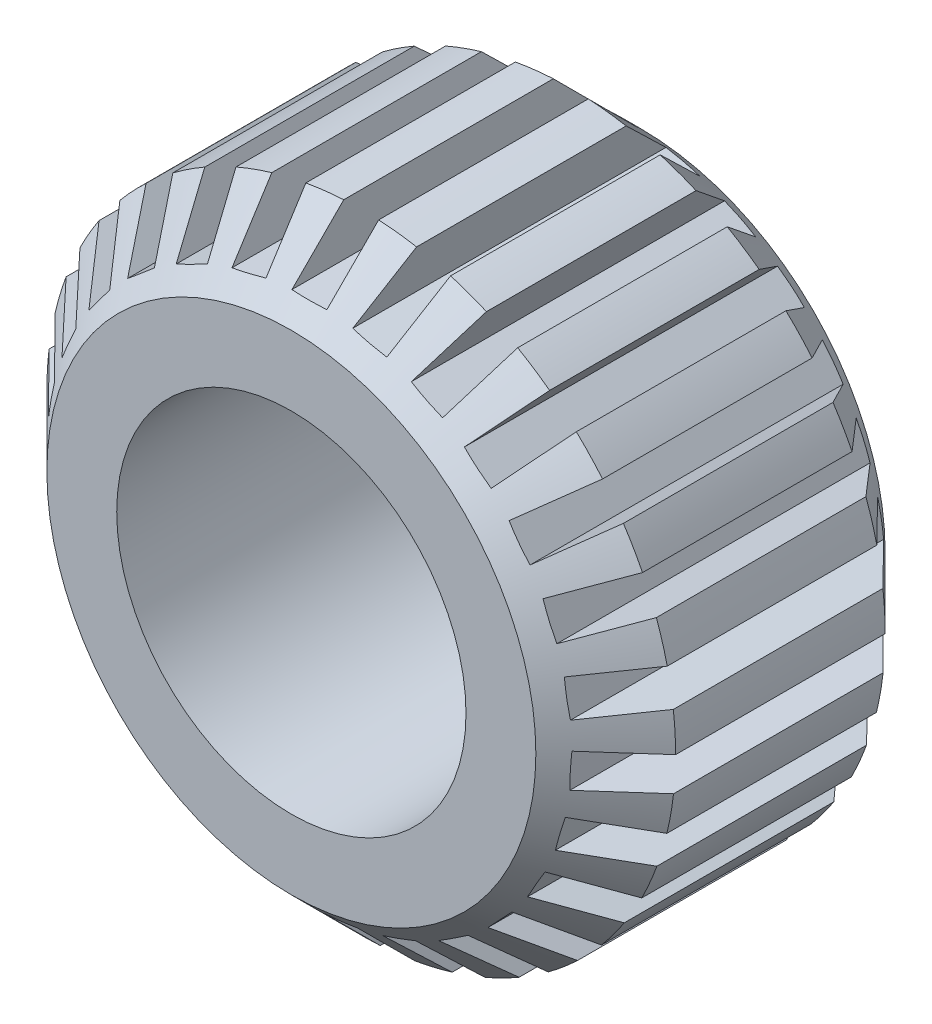
from build123d import *

# Parameters (mm, degrees)
SKETCH1_R           = 9
SKETCH1_R_2         = 5
BOSS_EXTRUDE1_DEPTH = 10
CHAMFER1_SIZE       = 2
CUT_EXTRUDE1_DEPTH  = 17.186414056
CIRPATTERN1_COUNT   = 27


with BuildPart() as part:
    # Sketch1 → Boss-Extrude1 (new body)
    with BuildSketch(Plane.XY):
        Circle(SKETCH1_R)
        Circle(SKETCH1_R_2, mode=Mode.SUBTRACT)
    extrude(amount=BOSS_EXTRUDE1_DEPTH)

    # Chamfer1
    chamfer1_edges = [part.edges().sort_by_distance(p)[0] for p in [
        (-9, 0, 0),
        (-9, 0, 10),
    ]]
    chamfer(chamfer1_edges, length=CHAMFER1_SIZE)

    # Sketch2 → Cut-Extrude1 (cut, through all)
    with BuildSketch(Plane.XY):
        with BuildLine():
            Line((-0.5, 7.5), (0.5, 7.5))
            Line((0.5, 7.5), (0.5, 8.986100378))
            ThreePointArc((0.5, 8.986100378), (0, 9), (-0.5, 8.986100378))
            Line((-0.5, 8.986100378), (-0.5, 7.5))
        make_face()
    cut_extrude1 = extrude(amount=CUT_EXTRUDE1_DEPTH, mode=Mode.SUBTRACT)

    # CirPattern1: Cut-Extrude1 ×27 about axis
    cirpattern1_axis = Axis((0, 0, 0), (0, 0, 1))
    for i in range(1, CIRPATTERN1_COUNT):
        add(cut_extrude1.rotate(cirpattern1_axis, i * 360 / CIRPATTERN1_COUNT), mode=Mode.SUBTRACT)


solid = part.part
